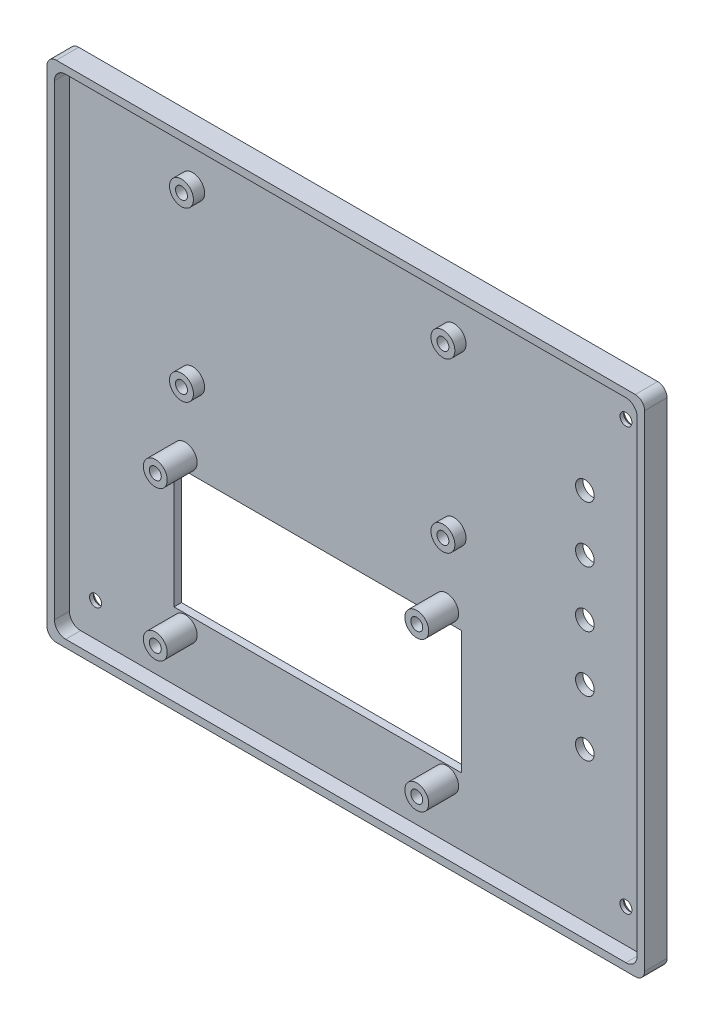
from build123d import *

# Parameters (mm, degrees)
ESQUISSE1_R             = 1.6
ESQUISSE1_R_2           = 2.5
BOSS_EXTRU_4_DEPTH      = 2
BOSS_EXTRU_5_DEPTH      = 6
ESQUISSE1_11_R          = 1.6
ENL_V_MAT_EXTRU_2_DEPTH = 17
ESQUISSE2_R             = 1.425347999
ESQUISSE2_R_2           = 0.949114843
ESQUISSE2_R_3           = 1.197099931
ESQUISSE2_R_4           = 1.451152233
ESQUISSE2_R_5           = 1.53234071
ESQUISSE2_R_6           = 0.524881037
ESQUISSE2_R_7           = 0.714215859
ESQUISSE2_R_8           = 1.859870893
ESQUISSE2_R_9           = 8.584531494
ESQUISSE2_W             = 11.746723458
ESQUISSE2_H             = 5.635661087
ENL_V_MAT_EXTRU_4_DEPTH = 11
ESQUISSE2_14_R          = 1.425347999
ESQUISSE2_14_R_2        = 0.949114843
ESQUISSE2_14_R_3        = 1.197099931
ESQUISSE2_14_R_4        = 1.451152233
ESQUISSE2_14_R_5        = 1.53234071
ESQUISSE2_14_R_6        = 0.524881037
ESQUISSE2_14_R_7        = 0.714215859
ESQUISSE2_14_R_8        = 1.859870893
ESQUISSE2_14_R_9        = 8.584531494
ESQUISSE2_14_W          = 11.746723458
ESQUISSE2_14_H          = 5.635661087
BOSS_EXTRU_9_DEPTH      = 1
ESQUISSE6_R             = 3.2
ESQUISSE6_R_2           = 1.6
ESQUISSE6_W             = 77
ESQUISSE6_H             = 33
BOSS_EXTRU_10_DEPTH     = 10
CHANFREIN3_SIZE         = 1
ESQUISSE6_6_W           = 77
ESQUISSE6_6_H           = 33
ENL_V_MAT_EXTRU_5_DEPTH = 10
ESQUISSE7_R             = 3.2
ESQUISSE7_R_2           = 1.6
BOSS_EXTRU_11_DEPTH     = 5
ESQUISSE2_16_R          = 1.425347999
ESQUISSE2_16_R_2        = 0.949114843
ESQUISSE2_16_R_3        = 1.197099931
ESQUISSE2_16_R_4        = 1.451152233
ESQUISSE2_16_R_5        = 1.53234071
ESQUISSE2_16_R_6        = 0.524881037
ESQUISSE2_16_R_7        = 0.714215859
ESQUISSE2_16_R_8        = 1.859870893
ESQUISSE2_16_R_9        = 8.584531494
ESQUISSE2_16_W          = 11.746723458
ESQUISSE2_16_H          = 5.635661087
ENL_V_MAT_EXTRU_7_DEPTH = 3
ESQUISSE2_17_R          = 1.425347999
ESQUISSE2_17_R_2        = 0.949114843
ESQUISSE2_17_R_3        = 1.197099931
ESQUISSE2_17_R_4        = 1.451152233
ESQUISSE2_17_R_5        = 1.53234071
ESQUISSE2_17_R_6        = 0.524881037
ESQUISSE2_17_R_7        = 0.714215859
ESQUISSE2_17_R_8        = 1.859870893
ESQUISSE2_17_R_9        = 8.584531494
ESQUISSE2_17_W          = 11.746723458
ESQUISSE2_17_H          = 5.635661087
BOSS_EXTRU_12_DEPTH     = 1


with BuildPart() as part:
    # Esquisse1 → Boss.-Extru.4 (new body)
    with BuildSketch(Plane.XY):
        with BuildLine():
            Line((5, 141.375707203), (155, 141.375707203))
            ThreePointArc((155, 141.375707203), (157.121320344, 140.497027547), (158, 138.375707203))
            Line((158, 138.375707203), (158, 13.375707203))
            ThreePointArc((158, 13.375707203), (157.121320344, 11.25438686), (155, 10.375707203))
            Line((155, 10.375707203), (5, 10.375707203))
            ThreePointArc((5, 10.375707203), (2.878679656, 11.25438686), (2, 13.375707203))
            Line((2, 13.375707203), (2, 138.375707203))
            ThreePointArc((2, 138.375707203), (2.878679656, 140.497027547), (5, 141.375707203))
        make_face()
        with Locations((151, 19.375707203)):
            Circle(ESQUISSE1_R, mode=Mode.SUBTRACT)
        with Locations((9, 19.375707203)):
            Circle(ESQUISSE1_R, mode=Mode.SUBTRACT)
        with Locations((140, 110.375707203)):
            Circle(ESQUISSE1_R_2, mode=Mode.SUBTRACT)
        with Locations((140, 95.375707203)):
            Circle(ESQUISSE1_R_2, mode=Mode.SUBTRACT)
        with Locations((140, 80.375707203)):
            Circle(ESQUISSE1_R_2, mode=Mode.SUBTRACT)
        with Locations((140, 65.375707203)):
            Circle(ESQUISSE1_R_2, mode=Mode.SUBTRACT)
        with Locations((140, 50.375707203)):
            Circle(ESQUISSE1_R_2, mode=Mode.SUBTRACT)
    extrude(amount=BOSS_EXTRU_4_DEPTH)

    # Esquisse1<10> → Boss.-Extru.5 (add)
    with BuildSketch(Plane.XY):
        with BuildLine():
            Line((160, 10.875707203), (160, 140.875707203))
            ThreePointArc((160, 140.875707203), (159.267766953, 142.643474156), (157.5, 143.375707203))
            Line((157.5, 143.375707203), (2.5, 143.375707203))
            ThreePointArc((2.5, 143.375707203), (0.732233047, 142.643474156), (0, 140.875707203))
            Line((0, 140.875707203), (0, 10.875707203))
            ThreePointArc((0, 10.875707203), (0.732233047, 9.10794025), (2.5, 8.375707203))
            Line((2.5, 8.375707203), (157.5, 8.375707203))
            ThreePointArc((157.5, 8.375707203), (159.267766953, 9.10794025), (160, 10.875707203))
        make_face()
        with BuildLine():
            Line((5, 141.375707203), (155, 141.375707203))
            ThreePointArc((155, 141.375707203), (157.121320344, 140.497027547), (158, 138.375707203))
            Line((158, 138.375707203), (158, 13.375707203))
            ThreePointArc((158, 13.375707203), (157.121320344, 11.25438686), (155, 10.375707203))
            Line((155, 10.375707203), (5, 10.375707203))
            ThreePointArc((5, 10.375707203), (2.878679656, 11.25438686), (2, 13.375707203))
            Line((2, 13.375707203), (2, 138.375707203))
            ThreePointArc((2, 138.375707203), (2.878679656, 140.497027547), (5, 141.375707203))
        make_face(mode=Mode.SUBTRACT)
    extrude(amount=BOSS_EXTRU_5_DEPTH)

    # Esquisse1<11> → Enlèv. mat.-Extru.2 (cut)
    with BuildSketch(Plane.XY):
        with Locations((151, 132.375707203)):
            Circle(ESQUISSE1_11_R)
    extrude(amount=ENL_V_MAT_EXTRU_2_DEPTH, mode=Mode.SUBTRACT)

    # Esquisse2 → Enlèv. mat.-Extru.4 (cut)
    # profile 1 of 21: a face of its own
    with BuildSketch(Plane.XY.offset(2)):
        with Locations((128.095238622, 53.263040654)):
            Circle(ESQUISSE2_R)
    # profile 2 of 21: a face of its own
    with BuildSketch(Plane.XY.offset(2)):
        with Locations((128.057640889, 68.716222213)):
            Circle(ESQUISSE2_R_2)
    # profile 3 of 21: a face of its own
    with BuildSketch(Plane.XY.offset(2)):
        with Locations((131.423355674, 67.255834332)):
            Circle(ESQUISSE2_R_3)
    # profile 4 of 21: a face of its own
    with BuildSketch(Plane.XY.offset(2)):
        with Locations((132.872511246, 63.877149775)):
            Circle(ESQUISSE2_R_4)
    # profile 5 of 21: a face of its own
    with BuildSketch(Plane.XY.offset(2)):
        with Locations((131.423355674, 60.479988933)):
            Circle(ESQUISSE2_R_5)
    # profile 6 of 21: a face of its own
    with BuildSketch(Plane.XY.offset(2)):
        with Locations((123.175143567, 63.877149775)):
            Circle(ESQUISSE2_R_6)
    # profile 7 of 21: a face of its own
    with BuildSketch(Plane.XY.offset(2)):
        with Locations((124.602892971, 67.255834332)):
            Circle(ESQUISSE2_R_7)
    # profile 8 of 21: a face of its own
    with BuildSketch(Plane.XY.offset(2)):
        with Locations((128.057640889, 59.005510778)):
            Circle(ESQUISSE2_R_8)
    # profile 9 of 21: a face of its own
    with BuildSketch(Plane.XY.offset(2)):
        with Locations((68, 100.802724187)):
            Circle(ESQUISSE2_R_9)
    # profile 10 of 21: a face of its own
    with BuildSketch(Plane.XY.offset(2)):
        with BuildLine():
            Line((123.303754263, 79.870243687), (123.303754263, 85.279308324))
            ThreePointArc((123.303754263, 85.279308324), (123.67304335, 86.170851047), (124.564586073, 86.540140134))
            Line((124.564586073, 86.540140134), (131.613072979, 86.540140134))
            ThreePointArc((131.613072979, 86.540140134), (132.504615701, 86.170851047), (132.873904788, 85.279308324))
            Line((132.873904788, 85.279308324), (132.873904788, 79.870243687))
            ThreePointArc((132.873904788, 79.870243687), (132.707913239, 79.282469785), (132.258981088, 78.86835473))
            Line((132.258981088, 78.86835473), (132.258981088, 75.815799904))
            ThreePointArc((132.258981088, 75.815799904), (127.905142842, 72.156536619), (123.89506624, 76.189575289))
            Line((123.89506624, 76.189575289), (123.89506624, 78.880698152))
            ThreePointArc((123.89506624, 78.880698152), (123.462844585, 79.293864857), (123.303754263, 79.870243687))
        make_face()
        with BuildLine():
            Line((130.49159584, 76.608752258), (130.49159584, 78.746598072))
            Line((130.49159584, 78.746598072), (125.722085828, 78.746598072))
            Line((125.722085828, 78.746598072), (125.722085828, 75.88597567))
            ThreePointArc((125.722085828, 75.88597567), (128.45040297, 73.98024149), (130.49159584, 76.608752258))
        make_face(mode=Mode.SUBTRACT)
    # profile 11 of 21: a face of its own
    with BuildSketch(Plane.XY.offset(2)):
        with BuildLine():
            Line((120.983921002, 92.096822785), (120.983921002, 93.637491412))
            Line((120.983921002, 93.637491412), (120.08467965, 93.637491412))
            ThreePointArc((120.08467965, 93.637491412), (119.653391193, 93.816136941), (119.474745664, 94.247425398))
            Line((119.474745664, 94.247425398), (119.474745664, 96.820020089))
            ThreePointArc((119.474745664, 96.820020089), (119.653391193, 97.251308546), (120.08467965, 97.429954075))
            Line((120.08467965, 97.429954075), (120.983921002, 97.429954075))
            Line((120.983921002, 97.429954075), (120.983921002, 98.953433777))
            ThreePointArc((120.983921002, 98.953433777), (121.162566531, 99.384722234), (121.593854988, 99.563367763))
            Line((121.593854988, 99.563367763), (134.559579154, 99.563367763))
            ThreePointArc((134.559579154, 99.563367763), (134.990867611, 99.384722234), (135.169513139, 98.953433777))
            Line((135.169513139, 98.953433777), (135.169513139, 92.096822785))
            ThreePointArc((135.169513139, 92.096822785), (134.990867611, 91.665534328), (134.559579154, 91.4868888))
            Line((134.559579154, 91.4868888), (121.593854988, 91.4868888))
            ThreePointArc((121.593854988, 91.4868888), (121.162566531, 91.665534328), (120.983921002, 92.096822785))
        make_face()
        with Locations((128.077883916, 95.524835467)):
            Rectangle(ESQUISSE2_W, ESQUISSE2_H, mode=Mode.SUBTRACT)
    # profile 12 of 21: a face of its own
    with BuildSketch(Plane.XY.offset(2)):
        with BuildLine():
            Line((128.12053621, 114.376425912), (135.917812233, 106.521354529))
            ThreePointArc((135.917812233, 106.521354529), (135.844927048, 104.325793757), (133.657481039, 104.527980088))
            Line((133.657481039, 104.527980088), (127.102630429, 111.13141689))
            Line((127.102630429, 111.13141689), (124.167740577, 108.222614435))
            ThreePointArc((124.167740577, 108.222614435), (121.996266637, 108.114029853), (121.967430522, 110.28802575))
            Line((121.967430522, 110.28802575), (126.047436153, 114.326733536))
            ThreePointArc((126.047436153, 114.326733536), (127.07328966, 114.79782444), (128.12053621, 114.376425912))
        make_face()
    # profile 13 of 21: a face of its own
    with BuildSketch(Plane.XY.offset(2)):
        with BuildLine():
            ThreePointArc((130.178315939, 51.245800709), (128.095426035, 50.363304791), (126.012422074, 51.245531463))
            ThreePointArc((126.012422074, 51.245531463), (124.942519326, 51.262572187), (124.925478601, 50.192669438))
            ThreePointArc((124.925478601, 50.192669438), (128.095523839, 48.850041911), (131.265395498, 50.193079194))
            ThreePointArc((131.265395498, 50.193079194), (131.248216476, 51.262979731), (130.178315939, 51.245800709))
        make_face()
    # profile 14 of 21: a face of its own
    with BuildSketch(Plane.XY.offset(2)):
        with BuildLine():
            ThreePointArc((132.046186029, 49.436966191), (128.095594086, 47.76314692), (124.144785815, 49.436455515))
            ThreePointArc((124.144785815, 49.436455515), (122.905690972, 49.456191022), (122.885955465, 48.21709618))
            ThreePointArc((122.885955465, 48.21709618), (128.095707356, 46.010579939), (133.305173984, 48.217769585))
            ThreePointArc((133.305173984, 48.217769585), (133.285278309, 49.456861866), (132.046186029, 49.436966191))
        make_face()
    # profile 15 of 21: a face of its own
    with BuildSketch(Plane.XY.offset(2)):
        with BuildLine():
            ThreePointArc((133.909931086, 47.632124937), (128.095761266, 45.168730307), (122.281273375, 47.631374083))
            ThreePointArc((122.281273375, 47.631374083), (121.212205755, 47.648401505), (121.195178332, 46.579333886))
            ThreePointArc((121.195178332, 46.579333886), (128.073844599, 43.65667243), (134.965460492, 46.548666549))
            ThreePointArc((134.965460492, 46.548666549), (134.995429628, 47.633752529), (133.909931086, 47.632124937))
        make_face()
    # profile 16 of 21: a face of its own
    with BuildSketch(Plane.XY.offset(2)):
        with BuildLine():
            ThreePointArc((80.520378533, 113.370871944), (85.740267069, 100.836502129), (80.568147756, 88.282345654))
            ThreePointArc((80.568147756, 88.282345654), (80.459364176, 85.382641971), (83.359067859, 85.27385839))
            ThreePointArc((83.359067859, 85.27385839), (89.841067345, 100.682658914), (83.528865797, 116.161792046))
            ThreePointArc((83.528865797, 116.161792046), (80.629162114, 116.270575627), (80.520378533, 113.370871944))
        make_face()
    # profile 17 of 21: a face of its own
    with BuildSketch(Plane.XY.offset(2)):
        with BuildLine():
            ThreePointArc((89.67044759, 119.650335778), (96.719437012, 100.616447142), (89.424139763, 81.675596936))
            ThreePointArc((89.424139763, 81.675596936), (89.54035636, 78.753992101), (92.461961195, 78.870208699))
            ThreePointArc((92.461961195, 78.870208699), (100.853635055, 100.554843461), (92.790119145, 122.363632655))
            ThreePointArc((92.790119145, 122.363632655), (89.873634929, 122.566819994), (89.67044759, 119.650335778))
        make_face()
    # profile 18 of 21: a face of its own
    with BuildSketch(Plane.XY.offset(2)):
        with BuildLine():
            ThreePointArc((98.409781519, 126.720664111), (107.955430794, 101.043497913), (98.719927688, 75.253155409))
            ThreePointArc((98.719927688, 75.253155409), (98.834681966, 72.413359821), (101.674477553, 72.528114099))
            ThreePointArc((101.674477553, 72.528114099), (111.97041914, 100.964757526), (101.465178931, 129.32474749))
            ThreePointArc((101.465178931, 129.32474749), (98.635438536, 129.550404507), (98.409781519, 126.720664111))
        make_face()
    # profile 19 of 21: a face of its own
    with BuildSketch(Plane.XY.offset(2)):
        with BuildLine():
            ThreePointArc((55.55265572, 113.370871944), (50.311375947, 100.888145145), (55.431852244, 88.355379908))
            ThreePointArc((55.431852244, 88.355379908), (55.498788333, 85.497523716), (52.640932141, 85.430587626))
            ThreePointArc((52.640932141, 85.430587626), (46.269756961, 100.793483219), (52.627863439, 116.161792046))
            ThreePointArc((52.627863439, 116.161792046), (55.485719631, 116.228728136), (55.55265572, 113.370871944))
        make_face()
    # profile 20 of 21: a face of its own
    with BuildSketch(Plane.XY.offset(2)):
        with BuildLine():
            ThreePointArc((46.272984902, 119.650392311), (39.237312663, 100.727917893), (46.371316588, 81.842296115))
            ThreePointArc((46.371316588, 81.842296115), (46.179264508, 78.920827851), (43.257796244, 79.112879931))
            ThreePointArc((43.257796244, 79.112879931), (35.096828914, 100.717149281), (43.145309387, 122.363576329))
            ThreePointArc((43.145309387, 122.363576329), (46.065739153, 122.570822078), (46.272984902, 119.650392311))
        make_face()
    # profile 21 of 21: a face of its own
    with BuildSketch(Plane.XY.offset(2)):
        with BuildLine():
            ThreePointArc((37.68725429, 126.694403458), (28.135107384, 100.98145495), (37.456311401, 75.183889423))
            ThreePointArc((37.456311401, 75.183889423), (37.203660251, 72.30268186), (34.322452688, 72.55533301))
            ThreePointArc((34.322452688, 72.55533301), (24.044869866, 100.999793173), (34.577090894, 129.350954398))
            ThreePointArc((34.577090894, 129.350954398), (37.460448062, 129.577760626), (37.68725429, 126.694403458))
        make_face()
    extrude(amount=-ENL_V_MAT_EXTRU_4_DEPTH, mode=Mode.SUBTRACT)


with BuildPart() as enl_v_mat_extru_4_piece_1:
    # of the separate pieces the step leaves, piece 1, a body of its own (enl_v_mat_extru_4_pieces)
    add(part.part.solids().sort_by_distance((152.6, 19.375707203, 0))[0])



with BuildPart() as enl_v_mat_extru_4_piece_2:
    # of the separate pieces the step leaves, piece 2, a body of its own (enl_v_mat_extru_4_pieces)
    add(part.part.solids().sort_by_distance((133.951245645, 98.342666011, 0))[0])


with BuildPart() as enl_v_mat_extru_4_piece_3:
    # of the separate pieces the step leaves, piece 3, a body of its own (enl_v_mat_extru_4_pieces)
    add(part.part.solids().sort_by_distance((125.722085828, 75.88597567, 0))[0])


with BuildPart() as enl_v_mat_extru_4_piece_1_1:
    add(enl_v_mat_extru_4_piece_1.part)

    add(enl_v_mat_extru_4_piece_2.part)  # Boss.-Extru.9 merges Enlèv. mat.-Extru.4 piece 2

    add(enl_v_mat_extru_4_piece_3.part)  # Boss.-Extru.9 merges Enlèv. mat.-Extru.4 piece 3
    # Esquisse2<14> → Boss.-Extru.9 (add)
    # profile 1 of 21: a face of its own
    with BuildSketch(Plane.XY.offset(2)):
        with Locations((128.095238622, 53.263040654)):
            Circle(ESQUISSE2_14_R)
    # profile 2 of 21: a face of its own
    with BuildSketch(Plane.XY.offset(2)):
        with Locations((128.057640889, 68.716222213)):
            Circle(ESQUISSE2_14_R_2)
    # profile 3 of 21: a face of its own
    with BuildSketch(Plane.XY.offset(2)):
        with Locations((131.423355674, 67.255834332)):
            Circle(ESQUISSE2_14_R_3)
    # profile 4 of 21: a face of its own
    with BuildSketch(Plane.XY.offset(2)):
        with Locations((132.872511246, 63.877149775)):
            Circle(ESQUISSE2_14_R_4)
    # profile 5 of 21: a face of its own
    with BuildSketch(Plane.XY.offset(2)):
        with Locations((131.423355674, 60.479988933)):
            Circle(ESQUISSE2_14_R_5)
    # profile 6 of 21: a face of its own
    with BuildSketch(Plane.XY.offset(2)):
        with Locations((123.175143567, 63.877149775)):
            Circle(ESQUISSE2_14_R_6)
    # profile 7 of 21: a face of its own
    with BuildSketch(Plane.XY.offset(2)):
        with Locations((124.602892971, 67.255834332)):
            Circle(ESQUISSE2_14_R_7)
    # profile 8 of 21: a face of its own
    with BuildSketch(Plane.XY.offset(2)):
        with Locations((128.057640889, 59.005510778)):
            Circle(ESQUISSE2_14_R_8)
    # profile 9 of 21: a face of its own
    with BuildSketch(Plane.XY.offset(2)):
        with Locations((68, 100.802724187)):
            Circle(ESQUISSE2_14_R_9)
    # profile 10 of 21: a face of its own
    with BuildSketch(Plane.XY.offset(2)):
        with BuildLine():
            Line((123.303754263, 79.870243687), (123.303754263, 85.279308324))
            ThreePointArc((123.303754263, 85.279308324), (123.67304335, 86.170851047), (124.564586073, 86.540140134))
            Line((124.564586073, 86.540140134), (131.613072979, 86.540140134))
            ThreePointArc((131.613072979, 86.540140134), (132.504615701, 86.170851047), (132.873904788, 85.279308324))
            Line((132.873904788, 85.279308324), (132.873904788, 79.870243687))
            ThreePointArc((132.873904788, 79.870243687), (132.707913239, 79.282469785), (132.258981088, 78.86835473))
            Line((132.258981088, 78.86835473), (132.258981088, 75.815799904))
            ThreePointArc((132.258981088, 75.815799904), (127.905142842, 72.156536619), (123.89506624, 76.189575289))
            Line((123.89506624, 76.189575289), (123.89506624, 78.880698152))
            ThreePointArc((123.89506624, 78.880698152), (123.462844585, 79.293864857), (123.303754263, 79.870243687))
        make_face()
        with BuildLine():
            Line((130.49159584, 76.608752258), (130.49159584, 78.746598072))
            Line((130.49159584, 78.746598072), (125.722085828, 78.746598072))
            Line((125.722085828, 78.746598072), (125.722085828, 75.88597567))
            ThreePointArc((125.722085828, 75.88597567), (128.45040297, 73.98024149), (130.49159584, 76.608752258))
        make_face(mode=Mode.SUBTRACT)
    # profile 11 of 21: a face of its own
    with BuildSketch(Plane.XY.offset(2)):
        with BuildLine():
            Line((120.983921002, 92.096822785), (120.983921002, 93.637491412))
            Line((120.983921002, 93.637491412), (120.08467965, 93.637491412))
            ThreePointArc((120.08467965, 93.637491412), (119.653391193, 93.816136941), (119.474745664, 94.247425398))
            Line((119.474745664, 94.247425398), (119.474745664, 96.820020089))
            ThreePointArc((119.474745664, 96.820020089), (119.653391193, 97.251308546), (120.08467965, 97.429954075))
            Line((120.08467965, 97.429954075), (120.983921002, 97.429954075))
            Line((120.983921002, 97.429954075), (120.983921002, 98.953433777))
            ThreePointArc((120.983921002, 98.953433777), (121.162566531, 99.384722234), (121.593854988, 99.563367763))
            Line((121.593854988, 99.563367763), (134.559579154, 99.563367763))
            ThreePointArc((134.559579154, 99.563367763), (134.990867611, 99.384722234), (135.169513139, 98.953433777))
            Line((135.169513139, 98.953433777), (135.169513139, 92.096822785))
            ThreePointArc((135.169513139, 92.096822785), (134.990867611, 91.665534328), (134.559579154, 91.4868888))
            Line((134.559579154, 91.4868888), (121.593854988, 91.4868888))
            ThreePointArc((121.593854988, 91.4868888), (121.162566531, 91.665534328), (120.983921002, 92.096822785))
        make_face()
        with Locations((128.077883916, 95.524835467)):
            Rectangle(ESQUISSE2_14_W, ESQUISSE2_14_H, mode=Mode.SUBTRACT)
    # profile 12 of 21: a face of its own
    with BuildSketch(Plane.XY.offset(2)):
        with BuildLine():
            Line((128.12053621, 114.376425912), (135.917812233, 106.521354529))
            ThreePointArc((135.917812233, 106.521354529), (135.844927048, 104.325793757), (133.657481039, 104.527980088))
            Line((133.657481039, 104.527980088), (127.102630429, 111.13141689))
            Line((127.102630429, 111.13141689), (124.167740577, 108.222614435))
            ThreePointArc((124.167740577, 108.222614435), (121.996266637, 108.114029853), (121.967430522, 110.28802575))
            Line((121.967430522, 110.28802575), (126.047436153, 114.326733536))
            ThreePointArc((126.047436153, 114.326733536), (127.07328966, 114.79782444), (128.12053621, 114.376425912))
        make_face()
    # profile 13 of 21: a face of its own
    with BuildSketch(Plane.XY.offset(2)):
        with BuildLine():
            ThreePointArc((130.178315939, 51.245800709), (128.095426035, 50.363304791), (126.012422074, 51.245531463))
            ThreePointArc((126.012422074, 51.245531463), (124.942519326, 51.262572187), (124.925478601, 50.192669438))
            ThreePointArc((124.925478601, 50.192669438), (128.095523839, 48.850041911), (131.265395498, 50.193079194))
            ThreePointArc((131.265395498, 50.193079194), (131.248216476, 51.262979731), (130.178315939, 51.245800709))
        make_face()
    # profile 14 of 21: a face of its own
    with BuildSketch(Plane.XY.offset(2)):
        with BuildLine():
            ThreePointArc((132.046186029, 49.436966191), (128.095594086, 47.76314692), (124.144785815, 49.436455515))
            ThreePointArc((124.144785815, 49.436455515), (122.905690972, 49.456191022), (122.885955465, 48.21709618))
            ThreePointArc((122.885955465, 48.21709618), (128.095707356, 46.010579939), (133.305173984, 48.217769585))
            ThreePointArc((133.305173984, 48.217769585), (133.285278309, 49.456861866), (132.046186029, 49.436966191))
        make_face()
    # profile 15 of 21: a face of its own
    with BuildSketch(Plane.XY.offset(2)):
        with BuildLine():
            ThreePointArc((133.909931086, 47.632124937), (128.095761266, 45.168730307), (122.281273375, 47.631374083))
            ThreePointArc((122.281273375, 47.631374083), (121.212205755, 47.648401505), (121.195178332, 46.579333886))
            ThreePointArc((121.195178332, 46.579333886), (128.073844599, 43.65667243), (134.965460492, 46.548666549))
            ThreePointArc((134.965460492, 46.548666549), (134.995429628, 47.633752529), (133.909931086, 47.632124937))
        make_face()
    # profile 16 of 21: a face of its own
    with BuildSketch(Plane.XY.offset(2)):
        with BuildLine():
            ThreePointArc((80.520378533, 113.370871944), (85.740267069, 100.836502129), (80.568147756, 88.282345654))
            ThreePointArc((80.568147756, 88.282345654), (80.459364176, 85.382641971), (83.359067859, 85.27385839))
            ThreePointArc((83.359067859, 85.27385839), (89.841067345, 100.682658914), (83.528865797, 116.161792046))
            ThreePointArc((83.528865797, 116.161792046), (80.629162114, 116.270575627), (80.520378533, 113.370871944))
        make_face()
    # profile 17 of 21: a face of its own
    with BuildSketch(Plane.XY.offset(2)):
        with BuildLine():
            ThreePointArc((89.67044759, 119.650335778), (96.719437012, 100.616447142), (89.424139763, 81.675596936))
            ThreePointArc((89.424139763, 81.675596936), (89.54035636, 78.753992101), (92.461961195, 78.870208699))
            ThreePointArc((92.461961195, 78.870208699), (100.853635055, 100.554843461), (92.790119145, 122.363632655))
            ThreePointArc((92.790119145, 122.363632655), (89.873634929, 122.566819994), (89.67044759, 119.650335778))
        make_face()
    # profile 18 of 21: a face of its own
    with BuildSketch(Plane.XY.offset(2)):
        with BuildLine():
            ThreePointArc((98.409781519, 126.720664111), (107.955430794, 101.043497913), (98.719927688, 75.253155409))
            ThreePointArc((98.719927688, 75.253155409), (98.834681966, 72.413359821), (101.674477553, 72.528114099))
            ThreePointArc((101.674477553, 72.528114099), (111.97041914, 100.964757526), (101.465178931, 129.32474749))
            ThreePointArc((101.465178931, 129.32474749), (98.635438536, 129.550404507), (98.409781519, 126.720664111))
        make_face()
    # profile 19 of 21: a face of its own
    with BuildSketch(Plane.XY.offset(2)):
        with BuildLine():
            ThreePointArc((55.55265572, 113.370871944), (50.311375947, 100.888145145), (55.431852244, 88.355379908))
            ThreePointArc((55.431852244, 88.355379908), (55.498788333, 85.497523716), (52.640932141, 85.430587626))
            ThreePointArc((52.640932141, 85.430587626), (46.269756961, 100.793483219), (52.627863439, 116.161792046))
            ThreePointArc((52.627863439, 116.161792046), (55.485719631, 116.228728136), (55.55265572, 113.370871944))
        make_face()
    # profile 20 of 21: a face of its own
    with BuildSketch(Plane.XY.offset(2)):
        with BuildLine():
            ThreePointArc((46.272984902, 119.650392311), (39.237312663, 100.727917893), (46.371316588, 81.842296115))
            ThreePointArc((46.371316588, 81.842296115), (46.179264508, 78.920827851), (43.257796244, 79.112879931))
            ThreePointArc((43.257796244, 79.112879931), (35.096828914, 100.717149281), (43.145309387, 122.363576329))
            ThreePointArc((43.145309387, 122.363576329), (46.065739153, 122.570822078), (46.272984902, 119.650392311))
        make_face()
    # profile 21 of 21: a face of its own
    with BuildSketch(Plane.XY.offset(2)):
        with BuildLine():
            ThreePointArc((37.68725429, 126.694403458), (28.135107384, 100.98145495), (37.456311401, 75.183889423))
            ThreePointArc((37.456311401, 75.183889423), (37.203660251, 72.30268186), (34.322452688, 72.55533301))
            ThreePointArc((34.322452688, 72.55533301), (24.044869866, 100.999793173), (34.577090894, 129.350954398))
            ThreePointArc((34.577090894, 129.350954398), (37.460448062, 129.577760626), (37.68725429, 126.694403458))
        make_face()
    extrude(amount=-BOSS_EXTRU_9_DEPTH)

    # Esquisse6 → Boss.-Extru.10 (add)
    # profile 1 of 5: a face of its own
    with BuildSketch(Plane(origin=(0, 0, 0), x_dir=(-1, 0, 0), z_dir=(0, 0, -1))):
        with Locations((-103, 64.875707203)):
            Circle(ESQUISSE6_R)
        with Locations((-103, 64.875707203)):
            Circle(ESQUISSE6_R_2, mode=Mode.SUBTRACT)
    # profile 2 of 5: a face of its own
    with BuildSketch(Plane(origin=(0, 0, 0), x_dir=(-1, 0, 0), z_dir=(0, 0, -1))):
        with Locations((-103, 24.875707203)):
            Circle(ESQUISSE6_R)
        with Locations((-103, 24.875707203)):
            Circle(ESQUISSE6_R_2, mode=Mode.SUBTRACT)
    # profile 3 of 5: a face of its own
    with BuildSketch(Plane(origin=(0, 0, 0), x_dir=(-1, 0, 0), z_dir=(0, 0, -1))):
        with Locations((-33, 24.875707203)):
            Circle(ESQUISSE6_R)
        with Locations((-33, 24.875707203)):
            Circle(ESQUISSE6_R_2, mode=Mode.SUBTRACT)
    # profile 4 of 5: a face of its own
    with BuildSketch(Plane(origin=(0, 0, 0), x_dir=(-1, 0, 0), z_dir=(0, 0, -1))):
        with Locations((-33, 64.875707203)):
            Circle(ESQUISSE6_R)
        with Locations((-33, 64.875707203)):
            Circle(ESQUISSE6_R_2, mode=Mode.SUBTRACT)
    # profile 5 of 5: a face of its own
    with BuildSketch(Plane(origin=(0, 0, 0), x_dir=(-1, 0, 0), z_dir=(0, 0, -1))):
        with Locations((-68.5, 44.875707203)):
            Rectangle(ESQUISSE6_W, ESQUISSE6_H)
    extrude(amount=-BOSS_EXTRU_10_DEPTH)

    # Chanfrein3
    chanfrein3_edges = [enl_v_mat_extru_4_piece_1_1.edges().sort_by_distance(p)[0] for p in [
        (149.4, 19.375707203, 0),
        (7.4, 19.375707203, 0),
        (149.4, 132.375707203, 0),
    ]]
    chamfer(chanfrein3_edges, length=CHANFREIN3_SIZE)

    # Esquisse6<6> → Enlèv. mat.-Extru.5 (cut)
    with BuildSketch(Plane(origin=(0, 0, 0), x_dir=(-1, 0, 0), z_dir=(0, 0, -1))):
        with Locations((-68.5, 44.875707203)):
            Rectangle(ESQUISSE6_6_W, ESQUISSE6_6_H)
    extrude(amount=-ENL_V_MAT_EXTRU_5_DEPTH, mode=Mode.SUBTRACT)

    # Esquisse7 → Boss.-Extru.11 (add)
    # profile 1 of 4: a face of its own
    with BuildSketch(Plane(origin=(0, 0, 0), x_dir=(-1, 0, 0), z_dir=(0, 0, -1))):
        with Locations((-35, 83.375707203)):
            Circle(ESQUISSE7_R)
        with Locations((-35, 83.375707203)):
            Circle(ESQUISSE7_R_2, mode=Mode.SUBTRACT)
    # profile 2 of 4: a face of its own
    with BuildSketch(Plane(origin=(0, 0, 0), x_dir=(-1, 0, 0), z_dir=(0, 0, -1))):
        with Locations((-35, 128.375707203)):
            Circle(ESQUISSE7_R)
        with Locations((-35, 128.375707203)):
            Circle(ESQUISSE7_R_2, mode=Mode.SUBTRACT)
    # profile 3 of 4: a face of its own
    with BuildSketch(Plane(origin=(0, 0, 0), x_dir=(-1, 0, 0), z_dir=(0, 0, -1))):
        with Locations((-105, 83.375707203)):
            Circle(ESQUISSE7_R)
        with Locations((-105, 83.375707203)):
            Circle(ESQUISSE7_R_2, mode=Mode.SUBTRACT)
    # profile 4 of 4: a face of its own
    with BuildSketch(Plane(origin=(0, 0, 0), x_dir=(-1, 0, 0), z_dir=(0, 0, -1))):
        with Locations((-105, 128.375707203)):
            Circle(ESQUISSE7_R)
        with Locations((-105, 128.375707203)):
            Circle(ESQUISSE7_R_2, mode=Mode.SUBTRACT)
    extrude(amount=-BOSS_EXTRU_11_DEPTH)

    # Esquisse2<16> → Enlèv. mat.-Extru.7 (cut)
    # profile 1 of 21: a face of its own
    with BuildSketch(Plane.XY.offset(2)):
        with Locations((128.095238622, 53.263040654)):
            Circle(ESQUISSE2_16_R)
    # profile 2 of 21: a face of its own
    with BuildSketch(Plane.XY.offset(2)):
        with Locations((128.057640889, 68.716222213)):
            Circle(ESQUISSE2_16_R_2)
    # profile 3 of 21: a face of its own
    with BuildSketch(Plane.XY.offset(2)):
        with Locations((131.423355674, 67.255834332)):
            Circle(ESQUISSE2_16_R_3)
    # profile 4 of 21: a face of its own
    with BuildSketch(Plane.XY.offset(2)):
        with Locations((132.872511246, 63.877149775)):
            Circle(ESQUISSE2_16_R_4)
    # profile 5 of 21: a face of its own
    with BuildSketch(Plane.XY.offset(2)):
        with Locations((131.423355674, 60.479988933)):
            Circle(ESQUISSE2_16_R_5)
    # profile 6 of 21: a face of its own
    with BuildSketch(Plane.XY.offset(2)):
        with Locations((123.175143567, 63.877149775)):
            Circle(ESQUISSE2_16_R_6)
    # profile 7 of 21: a face of its own
    with BuildSketch(Plane.XY.offset(2)):
        with Locations((124.602892971, 67.255834332)):
            Circle(ESQUISSE2_16_R_7)
    # profile 8 of 21: a face of its own
    with BuildSketch(Plane.XY.offset(2)):
        with Locations((128.057640889, 59.005510778)):
            Circle(ESQUISSE2_16_R_8)
    # profile 9 of 21: a face of its own
    with BuildSketch(Plane.XY.offset(2)):
        with Locations((68, 100.802724187)):
            Circle(ESQUISSE2_16_R_9)
    # profile 10 of 21: a face of its own
    with BuildSketch(Plane.XY.offset(2)):
        with BuildLine():
            Line((123.303754263, 79.870243687), (123.303754263, 85.279308324))
            ThreePointArc((123.303754263, 85.279308324), (123.67304335, 86.170851047), (124.564586073, 86.540140134))
            Line((124.564586073, 86.540140134), (131.613072979, 86.540140134))
            ThreePointArc((131.613072979, 86.540140134), (132.504615701, 86.170851047), (132.873904788, 85.279308324))
            Line((132.873904788, 85.279308324), (132.873904788, 79.870243687))
            ThreePointArc((132.873904788, 79.870243687), (132.707913239, 79.282469785), (132.258981088, 78.86835473))
            Line((132.258981088, 78.86835473), (132.258981088, 75.815799904))
            ThreePointArc((132.258981088, 75.815799904), (127.905142842, 72.156536619), (123.89506624, 76.189575289))
            Line((123.89506624, 76.189575289), (123.89506624, 78.880698152))
            ThreePointArc((123.89506624, 78.880698152), (123.462844585, 79.293864857), (123.303754263, 79.870243687))
        make_face()
        with BuildLine():
            Line((130.49159584, 76.608752258), (130.49159584, 78.746598072))
            Line((130.49159584, 78.746598072), (125.722085828, 78.746598072))
            Line((125.722085828, 78.746598072), (125.722085828, 75.88597567))
            ThreePointArc((125.722085828, 75.88597567), (128.45040297, 73.98024149), (130.49159584, 76.608752258))
        make_face(mode=Mode.SUBTRACT)
    # profile 11 of 21: a face of its own
    with BuildSketch(Plane.XY.offset(2)):
        with BuildLine():
            Line((120.983921002, 92.096822785), (120.983921002, 93.637491412))
            Line((120.983921002, 93.637491412), (120.08467965, 93.637491412))
            ThreePointArc((120.08467965, 93.637491412), (119.653391193, 93.816136941), (119.474745664, 94.247425398))
            Line((119.474745664, 94.247425398), (119.474745664, 96.820020089))
            ThreePointArc((119.474745664, 96.820020089), (119.653391193, 97.251308546), (120.08467965, 97.429954075))
            Line((120.08467965, 97.429954075), (120.983921002, 97.429954075))
            Line((120.983921002, 97.429954075), (120.983921002, 98.953433777))
            ThreePointArc((120.983921002, 98.953433777), (121.162566531, 99.384722234), (121.593854988, 99.563367763))
            Line((121.593854988, 99.563367763), (134.559579154, 99.563367763))
            ThreePointArc((134.559579154, 99.563367763), (134.990867611, 99.384722234), (135.169513139, 98.953433777))
            Line((135.169513139, 98.953433777), (135.169513139, 92.096822785))
            ThreePointArc((135.169513139, 92.096822785), (134.990867611, 91.665534328), (134.559579154, 91.4868888))
            Line((134.559579154, 91.4868888), (121.593854988, 91.4868888))
            ThreePointArc((121.593854988, 91.4868888), (121.162566531, 91.665534328), (120.983921002, 92.096822785))
        make_face()
        with Locations((128.077883916, 95.524835467)):
            Rectangle(ESQUISSE2_16_W, ESQUISSE2_16_H, mode=Mode.SUBTRACT)
    # profile 12 of 21: a face of its own
    with BuildSketch(Plane.XY.offset(2)):
        with BuildLine():
            Line((128.12053621, 114.376425912), (135.917812233, 106.521354529))
            ThreePointArc((135.917812233, 106.521354529), (135.844927048, 104.325793757), (133.657481039, 104.527980088))
            Line((133.657481039, 104.527980088), (127.102630429, 111.13141689))
            Line((127.102630429, 111.13141689), (124.167740577, 108.222614435))
            ThreePointArc((124.167740577, 108.222614435), (121.996266637, 108.114029853), (121.967430522, 110.28802575))
            Line((121.967430522, 110.28802575), (126.047436153, 114.326733536))
            ThreePointArc((126.047436153, 114.326733536), (127.07328966, 114.79782444), (128.12053621, 114.376425912))
        make_face()
    # profile 13 of 21: a face of its own
    with BuildSketch(Plane.XY.offset(2)):
        with BuildLine():
            ThreePointArc((130.178315939, 51.245800709), (128.095426035, 50.363304791), (126.012422074, 51.245531463))
            ThreePointArc((126.012422074, 51.245531463), (124.942519326, 51.262572187), (124.925478601, 50.192669438))
            ThreePointArc((124.925478601, 50.192669438), (128.095523839, 48.850041911), (131.265395498, 50.193079194))
            ThreePointArc((131.265395498, 50.193079194), (131.248216476, 51.262979731), (130.178315939, 51.245800709))
        make_face()
    # profile 14 of 21: a face of its own
    with BuildSketch(Plane.XY.offset(2)):
        with BuildLine():
            ThreePointArc((132.046186029, 49.436966191), (128.095594086, 47.76314692), (124.144785815, 49.436455515))
            ThreePointArc((124.144785815, 49.436455515), (122.905690972, 49.456191022), (122.885955465, 48.21709618))
            ThreePointArc((122.885955465, 48.21709618), (128.095707356, 46.010579939), (133.305173984, 48.217769585))
            ThreePointArc((133.305173984, 48.217769585), (133.285278309, 49.456861866), (132.046186029, 49.436966191))
        make_face()
    # profile 15 of 21: a face of its own
    with BuildSketch(Plane.XY.offset(2)):
        with BuildLine():
            ThreePointArc((133.909931086, 47.632124937), (128.095761266, 45.168730307), (122.281273375, 47.631374083))
            ThreePointArc((122.281273375, 47.631374083), (121.212205755, 47.648401505), (121.195178332, 46.579333886))
            ThreePointArc((121.195178332, 46.579333886), (128.073844599, 43.65667243), (134.965460492, 46.548666549))
            ThreePointArc((134.965460492, 46.548666549), (134.995429628, 47.633752529), (133.909931086, 47.632124937))
        make_face()
    # profile 16 of 21: a face of its own
    with BuildSketch(Plane.XY.offset(2)):
        with BuildLine():
            ThreePointArc((80.520378533, 113.370871944), (85.740267069, 100.836502129), (80.568147756, 88.282345654))
            ThreePointArc((80.568147756, 88.282345654), (80.459364176, 85.382641971), (83.359067859, 85.27385839))
            ThreePointArc((83.359067859, 85.27385839), (89.841067345, 100.682658914), (83.528865797, 116.161792046))
            ThreePointArc((83.528865797, 116.161792046), (80.629162114, 116.270575627), (80.520378533, 113.370871944))
        make_face()
    # profile 17 of 21: a face of its own
    with BuildSketch(Plane.XY.offset(2)):
        with BuildLine():
            ThreePointArc((89.67044759, 119.650335778), (96.719437012, 100.616447142), (89.424139763, 81.675596936))
            ThreePointArc((89.424139763, 81.675596936), (89.54035636, 78.753992101), (92.461961195, 78.870208699))
            ThreePointArc((92.461961195, 78.870208699), (100.853635055, 100.554843461), (92.790119145, 122.363632655))
            ThreePointArc((92.790119145, 122.363632655), (89.873634929, 122.566819994), (89.67044759, 119.650335778))
        make_face()
    # profile 18 of 21: a face of its own
    with BuildSketch(Plane.XY.offset(2)):
        with BuildLine():
            ThreePointArc((98.409781519, 126.720664111), (107.955430794, 101.043497913), (98.719927688, 75.253155409))
            ThreePointArc((98.719927688, 75.253155409), (98.834681966, 72.413359821), (101.674477553, 72.528114099))
            ThreePointArc((101.674477553, 72.528114099), (111.97041914, 100.964757526), (101.465178931, 129.32474749))
            ThreePointArc((101.465178931, 129.32474749), (98.635438536, 129.550404507), (98.409781519, 126.720664111))
        make_face()
    # profile 19 of 21: a face of its own
    with BuildSketch(Plane.XY.offset(2)):
        with BuildLine():
            ThreePointArc((55.55265572, 113.370871944), (50.311375947, 100.888145145), (55.431852244, 88.355379908))
            ThreePointArc((55.431852244, 88.355379908), (55.498788333, 85.497523716), (52.640932141, 85.430587626))
            ThreePointArc((52.640932141, 85.430587626), (46.269756961, 100.793483219), (52.627863439, 116.161792046))
            ThreePointArc((52.627863439, 116.161792046), (55.485719631, 116.228728136), (55.55265572, 113.370871944))
        make_face()
    # profile 20 of 21: a face of its own
    with BuildSketch(Plane.XY.offset(2)):
        with BuildLine():
            ThreePointArc((46.272984902, 119.650392311), (39.237312663, 100.727917893), (46.371316588, 81.842296115))
            ThreePointArc((46.371316588, 81.842296115), (46.179264508, 78.920827851), (43.257796244, 79.112879931))
            ThreePointArc((43.257796244, 79.112879931), (35.096828914, 100.717149281), (43.145309387, 122.363576329))
            ThreePointArc((43.145309387, 122.363576329), (46.065739153, 122.570822078), (46.272984902, 119.650392311))
        make_face()
    # profile 21 of 21: a face of its own
    with BuildSketch(Plane.XY.offset(2)):
        with BuildLine():
            ThreePointArc((37.68725429, 126.694403458), (28.135107384, 100.98145495), (37.456311401, 75.183889423))
            ThreePointArc((37.456311401, 75.183889423), (37.203660251, 72.30268186), (34.322452688, 72.55533301))
            ThreePointArc((34.322452688, 72.55533301), (24.044869866, 100.999793173), (34.577090894, 129.350954398))
            ThreePointArc((34.577090894, 129.350954398), (37.460448062, 129.577760626), (37.68725429, 126.694403458))
        make_face()
    extrude(amount=-ENL_V_MAT_EXTRU_7_DEPTH, mode=Mode.SUBTRACT)


with BuildPart() as enl_v_mat_extru_7_piece_1:
    # of the separate pieces the step leaves, piece 1, a body of its own (enl_v_mat_extru_7_pieces)
    add(enl_v_mat_extru_4_piece_1_1.part.solids().sort_by_distance((157.5, 8.375707203, 0))[0])



with BuildPart() as enl_v_mat_extru_7_piece_2:
    # of the separate pieces the step leaves, piece 2, a body of its own (enl_v_mat_extru_7_pieces)
    add(enl_v_mat_extru_4_piece_1_1.part.solids().sort_by_distance((133.951245645, 98.342666011, 2))[0])


with BuildPart() as enl_v_mat_extru_7_piece_3:
    # of the separate pieces the step leaves, piece 3, a body of its own (enl_v_mat_extru_7_pieces)
    add(enl_v_mat_extru_4_piece_1_1.part.solids().sort_by_distance((130.49159584, 76.608752258, 0))[0])


with BuildPart() as enl_v_mat_extru_7_piece_1_1:
    add(enl_v_mat_extru_7_piece_1.part)

    add(enl_v_mat_extru_7_piece_2.part)  # Boss.-Extru.12 merges Enlèv. mat.-Extru.7 piece 2

    add(enl_v_mat_extru_7_piece_3.part)  # Boss.-Extru.12 merges Enlèv. mat.-Extru.7 piece 3
    # Esquisse2<17> → Boss.-Extru.12 (add)
    # profile 1 of 21: a face of its own
    with BuildSketch(Plane.XY.offset(2)):
        with Locations((128.095238622, 53.263040654)):
            Circle(ESQUISSE2_17_R)
    # profile 2 of 21: a face of its own
    with BuildSketch(Plane.XY.offset(2)):
        with Locations((128.057640889, 68.716222213)):
            Circle(ESQUISSE2_17_R_2)
    # profile 3 of 21: a face of its own
    with BuildSketch(Plane.XY.offset(2)):
        with Locations((131.423355674, 67.255834332)):
            Circle(ESQUISSE2_17_R_3)
    # profile 4 of 21: a face of its own
    with BuildSketch(Plane.XY.offset(2)):
        with Locations((132.872511246, 63.877149775)):
            Circle(ESQUISSE2_17_R_4)
    # profile 5 of 21: a face of its own
    with BuildSketch(Plane.XY.offset(2)):
        with Locations((131.423355674, 60.479988933)):
            Circle(ESQUISSE2_17_R_5)
    # profile 6 of 21: a face of its own
    with BuildSketch(Plane.XY.offset(2)):
        with Locations((123.175143567, 63.877149775)):
            Circle(ESQUISSE2_17_R_6)
    # profile 7 of 21: a face of its own
    with BuildSketch(Plane.XY.offset(2)):
        with Locations((124.602892971, 67.255834332)):
            Circle(ESQUISSE2_17_R_7)
    # profile 8 of 21: a face of its own
    with BuildSketch(Plane.XY.offset(2)):
        with Locations((128.057640889, 59.005510778)):
            Circle(ESQUISSE2_17_R_8)
    # profile 9 of 21: a face of its own
    with BuildSketch(Plane.XY.offset(2)):
        with Locations((68, 100.802724187)):
            Circle(ESQUISSE2_17_R_9)
    # profile 10 of 21: a face of its own
    with BuildSketch(Plane.XY.offset(2)):
        with BuildLine():
            Line((123.303754263, 79.870243687), (123.303754263, 85.279308324))
            ThreePointArc((123.303754263, 85.279308324), (123.67304335, 86.170851047), (124.564586073, 86.540140134))
            Line((124.564586073, 86.540140134), (131.613072979, 86.540140134))
            ThreePointArc((131.613072979, 86.540140134), (132.504615701, 86.170851047), (132.873904788, 85.279308324))
            Line((132.873904788, 85.279308324), (132.873904788, 79.870243687))
            ThreePointArc((132.873904788, 79.870243687), (132.707913239, 79.282469785), (132.258981088, 78.86835473))
            Line((132.258981088, 78.86835473), (132.258981088, 75.815799904))
            ThreePointArc((132.258981088, 75.815799904), (127.905142842, 72.156536619), (123.89506624, 76.189575289))
            Line((123.89506624, 76.189575289), (123.89506624, 78.880698152))
            ThreePointArc((123.89506624, 78.880698152), (123.462844585, 79.293864857), (123.303754263, 79.870243687))
        make_face()
        with BuildLine():
            Line((130.49159584, 76.608752258), (130.49159584, 78.746598072))
            Line((130.49159584, 78.746598072), (125.722085828, 78.746598072))
            Line((125.722085828, 78.746598072), (125.722085828, 75.88597567))
            ThreePointArc((125.722085828, 75.88597567), (128.45040297, 73.98024149), (130.49159584, 76.608752258))
        make_face(mode=Mode.SUBTRACT)
    # profile 11 of 21: a face of its own
    with BuildSketch(Plane.XY.offset(2)):
        with BuildLine():
            Line((120.983921002, 92.096822785), (120.983921002, 93.637491412))
            Line((120.983921002, 93.637491412), (120.08467965, 93.637491412))
            ThreePointArc((120.08467965, 93.637491412), (119.653391193, 93.816136941), (119.474745664, 94.247425398))
            Line((119.474745664, 94.247425398), (119.474745664, 96.820020089))
            ThreePointArc((119.474745664, 96.820020089), (119.653391193, 97.251308546), (120.08467965, 97.429954075))
            Line((120.08467965, 97.429954075), (120.983921002, 97.429954075))
            Line((120.983921002, 97.429954075), (120.983921002, 98.953433777))
            ThreePointArc((120.983921002, 98.953433777), (121.162566531, 99.384722234), (121.593854988, 99.563367763))
            Line((121.593854988, 99.563367763), (134.559579154, 99.563367763))
            ThreePointArc((134.559579154, 99.563367763), (134.990867611, 99.384722234), (135.169513139, 98.953433777))
            Line((135.169513139, 98.953433777), (135.169513139, 92.096822785))
            ThreePointArc((135.169513139, 92.096822785), (134.990867611, 91.665534328), (134.559579154, 91.4868888))
            Line((134.559579154, 91.4868888), (121.593854988, 91.4868888))
            ThreePointArc((121.593854988, 91.4868888), (121.162566531, 91.665534328), (120.983921002, 92.096822785))
        make_face()
        with Locations((128.077883916, 95.524835467)):
            Rectangle(ESQUISSE2_17_W, ESQUISSE2_17_H, mode=Mode.SUBTRACT)
    # profile 12 of 21: a face of its own
    with BuildSketch(Plane.XY.offset(2)):
        with BuildLine():
            Line((128.12053621, 114.376425912), (135.917812233, 106.521354529))
            ThreePointArc((135.917812233, 106.521354529), (135.844927048, 104.325793757), (133.657481039, 104.527980088))
            Line((133.657481039, 104.527980088), (127.102630429, 111.13141689))
            Line((127.102630429, 111.13141689), (124.167740577, 108.222614435))
            ThreePointArc((124.167740577, 108.222614435), (121.996266637, 108.114029853), (121.967430522, 110.28802575))
            Line((121.967430522, 110.28802575), (126.047436153, 114.326733536))
            ThreePointArc((126.047436153, 114.326733536), (127.07328966, 114.79782444), (128.12053621, 114.376425912))
        make_face()
    # profile 13 of 21: a face of its own
    with BuildSketch(Plane.XY.offset(2)):
        with BuildLine():
            ThreePointArc((130.178315939, 51.245800709), (128.095426035, 50.363304791), (126.012422074, 51.245531463))
            ThreePointArc((126.012422074, 51.245531463), (124.942519326, 51.262572187), (124.925478601, 50.192669438))
            ThreePointArc((124.925478601, 50.192669438), (128.095523839, 48.850041911), (131.265395498, 50.193079194))
            ThreePointArc((131.265395498, 50.193079194), (131.248216476, 51.262979731), (130.178315939, 51.245800709))
        make_face()
    # profile 14 of 21: a face of its own
    with BuildSketch(Plane.XY.offset(2)):
        with BuildLine():
            ThreePointArc((132.046186029, 49.436966191), (128.095594086, 47.76314692), (124.144785815, 49.436455515))
            ThreePointArc((124.144785815, 49.436455515), (122.905690972, 49.456191022), (122.885955465, 48.21709618))
            ThreePointArc((122.885955465, 48.21709618), (128.095707356, 46.010579939), (133.305173984, 48.217769585))
            ThreePointArc((133.305173984, 48.217769585), (133.285278309, 49.456861866), (132.046186029, 49.436966191))
        make_face()
    # profile 15 of 21: a face of its own
    with BuildSketch(Plane.XY.offset(2)):
        with BuildLine():
            ThreePointArc((133.909931086, 47.632124937), (128.095761266, 45.168730307), (122.281273375, 47.631374083))
            ThreePointArc((122.281273375, 47.631374083), (121.212205755, 47.648401505), (121.195178332, 46.579333886))
            ThreePointArc((121.195178332, 46.579333886), (128.073844599, 43.65667243), (134.965460492, 46.548666549))
            ThreePointArc((134.965460492, 46.548666549), (134.995429628, 47.633752529), (133.909931086, 47.632124937))
        make_face()
    # profile 16 of 21: a face of its own
    with BuildSketch(Plane.XY.offset(2)):
        with BuildLine():
            ThreePointArc((80.520378533, 113.370871944), (85.740267069, 100.836502129), (80.568147756, 88.282345654))
            ThreePointArc((80.568147756, 88.282345654), (80.459364176, 85.382641971), (83.359067859, 85.27385839))
            ThreePointArc((83.359067859, 85.27385839), (89.841067345, 100.682658914), (83.528865797, 116.161792046))
            ThreePointArc((83.528865797, 116.161792046), (80.629162114, 116.270575627), (80.520378533, 113.370871944))
        make_face()
    # profile 17 of 21: a face of its own
    with BuildSketch(Plane.XY.offset(2)):
        with BuildLine():
            ThreePointArc((89.67044759, 119.650335778), (96.719437012, 100.616447142), (89.424139763, 81.675596936))
            ThreePointArc((89.424139763, 81.675596936), (89.54035636, 78.753992101), (92.461961195, 78.870208699))
            ThreePointArc((92.461961195, 78.870208699), (100.853635055, 100.554843461), (92.790119145, 122.363632655))
            ThreePointArc((92.790119145, 122.363632655), (89.873634929, 122.566819994), (89.67044759, 119.650335778))
        make_face()
    # profile 18 of 21: a face of its own
    with BuildSketch(Plane.XY.offset(2)):
        with BuildLine():
            ThreePointArc((98.409781519, 126.720664111), (107.955430794, 101.043497913), (98.719927688, 75.253155409))
            ThreePointArc((98.719927688, 75.253155409), (98.834681966, 72.413359821), (101.674477553, 72.528114099))
            ThreePointArc((101.674477553, 72.528114099), (111.97041914, 100.964757526), (101.465178931, 129.32474749))
            ThreePointArc((101.465178931, 129.32474749), (98.635438536, 129.550404507), (98.409781519, 126.720664111))
        make_face()
    # profile 19 of 21: a face of its own
    with BuildSketch(Plane.XY.offset(2)):
        with BuildLine():
            ThreePointArc((55.55265572, 113.370871944), (50.311375947, 100.888145145), (55.431852244, 88.355379908))
            ThreePointArc((55.431852244, 88.355379908), (55.498788333, 85.497523716), (52.640932141, 85.430587626))
            ThreePointArc((52.640932141, 85.430587626), (46.269756961, 100.793483219), (52.627863439, 116.161792046))
            ThreePointArc((52.627863439, 116.161792046), (55.485719631, 116.228728136), (55.55265572, 113.370871944))
        make_face()
    # profile 20 of 21: a face of its own
    with BuildSketch(Plane.XY.offset(2)):
        with BuildLine():
            ThreePointArc((46.272984902, 119.650392311), (39.237312663, 100.727917893), (46.371316588, 81.842296115))
            ThreePointArc((46.371316588, 81.842296115), (46.179264508, 78.920827851), (43.257796244, 79.112879931))
            ThreePointArc((43.257796244, 79.112879931), (35.096828914, 100.717149281), (43.145309387, 122.363576329))
            ThreePointArc((43.145309387, 122.363576329), (46.065739153, 122.570822078), (46.272984902, 119.650392311))
        make_face()
    # profile 21 of 21: a face of its own
    with BuildSketch(Plane.XY.offset(2)):
        with BuildLine():
            ThreePointArc((37.68725429, 126.694403458), (28.135107384, 100.98145495), (37.456311401, 75.183889423))
            ThreePointArc((37.456311401, 75.183889423), (37.203660251, 72.30268186), (34.322452688, 72.55533301))
            ThreePointArc((34.322452688, 72.55533301), (24.044869866, 100.999793173), (34.577090894, 129.350954398))
            ThreePointArc((34.577090894, 129.350954398), (37.460448062, 129.577760626), (37.68725429, 126.694403458))
        make_face()
    extrude(amount=-BOSS_EXTRU_12_DEPTH)


solid = enl_v_mat_extru_7_piece_1_1.part
